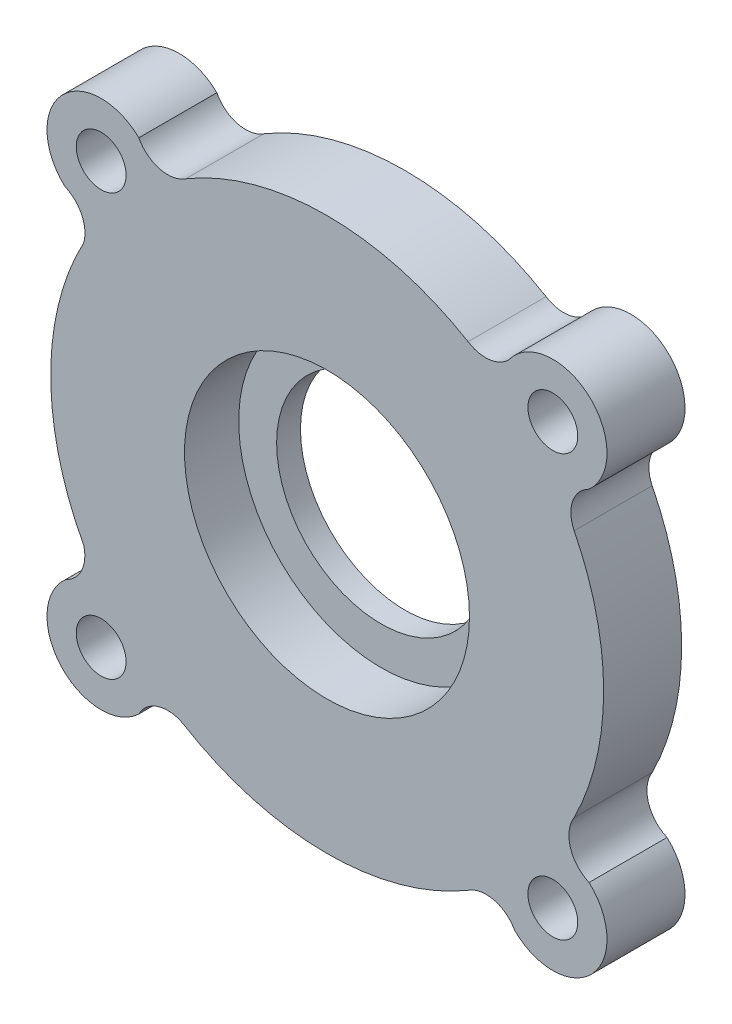
from build123d import *

# Parameters (mm, degrees)
SKETCH_1_R          = 9.65
SKETCH_1_R_2        = 2.3
EXTRUDE_1_DEPTH     = 7.2
SKETCH_3_R          = 13.15
CUT_EXTRUDE_2_DEPTH = 5


with BuildPart() as part:
    # Эскиз1 → Бобышка-Вытянуть1 (new body)
    with BuildSketch(Plane.XY):
        with BuildLine():
            ThreePointArc((17.318617894, -22.983026957), (24.476839341, -22.871983126), (24.186521915, -15.718789377))
            ThreePointArc((24.186521915, -15.718789377), (22.460060734, -13.780241769), (22.814213614, -11.208625395))
            ThreePointArc((22.814213614, -11.208625395), (25.533378767, 0.249278588), (22.814213614, 11.70718257))
            ThreePointArc((22.814213614, 11.70718257), (22.670312845, 13.996934853), (24.186521915, 15.718789377))
            ThreePointArc((24.186521915, 15.718789377), (24.192075469, 23.150116525), (16.80084997, 22.379117413))
            ThreePointArc((16.80084997, 22.379117413), (14.991093622, 21.475474964), (13.019103812, 21.9260789))
            ThreePointArc((13.019103812, 21.9260789), (0, 25.5), (-13.019103812, 21.9260789))
            ThreePointArc((-13.019103812, 21.9260789), (-15.441695163, 21.501443825), (-17.367665677, 23.031117444))
            ThreePointArc((-17.367665677, 23.031117444), (-24.500349004, 22.846945062), (-24.186521915, 15.718789377))
            ThreePointArc((-24.186521915, 15.718789377), (-22.63170124, 14.227973239), (-22.456592697, 12.081036563))
            ThreePointArc((-22.456592697, 12.081036563), (-25.499999999, 0.00027459), (-22.456852874, -12.080552925))
            ThreePointArc((-22.456852874, -12.080552925), (-22.637866377, -14.173636235), (-24.121378881, -15.66123641))
            ThreePointArc((-24.121378881, -15.66123641), (-24.52985221, -22.815029764), (-17.367665677, -23.031117444))
            ThreePointArc((-17.367665677, -23.031117444), (-15.572046271, -21.539672856), (-13.250925173, -21.786761624))
            ThreePointArc((-13.250925173, -21.786761624), (-0.135231696, -25.499641417), (13.019103812, -21.9260789))
            ThreePointArc((13.019103812, -21.9260789), (15.401695473, -21.507414874), (17.318617894, -22.983026957))
        make_face()
        Circle(SKETCH_1_R, mode=Mode.SUBTRACT)
        with Locations((-20.843580496, -19.436953262)):
            Circle(SKETCH_1_R_2, mode=Mode.SUBTRACT)
        with Locations((20.843580496, -19.436953262)):
            Circle(SKETCH_1_R_2, mode=Mode.SUBTRACT)
        with Locations((20.843580496, 19.436953262)):
            Circle(SKETCH_1_R_2, mode=Mode.SUBTRACT)
        with Locations((-20.843580496, 19.436953262)):
            Circle(SKETCH_1_R_2, mode=Mode.SUBTRACT)
    extrude(amount=EXTRUDE_1_DEPTH)

    # Эскиз3 → Вырез-Вытянуть2 (cut)
    with BuildSketch(Plane.XY.offset(7.2)):
        Circle(SKETCH_3_R)
    extrude(amount=-CUT_EXTRUDE_2_DEPTH, mode=Mode.SUBTRACT)


solid = part.part
